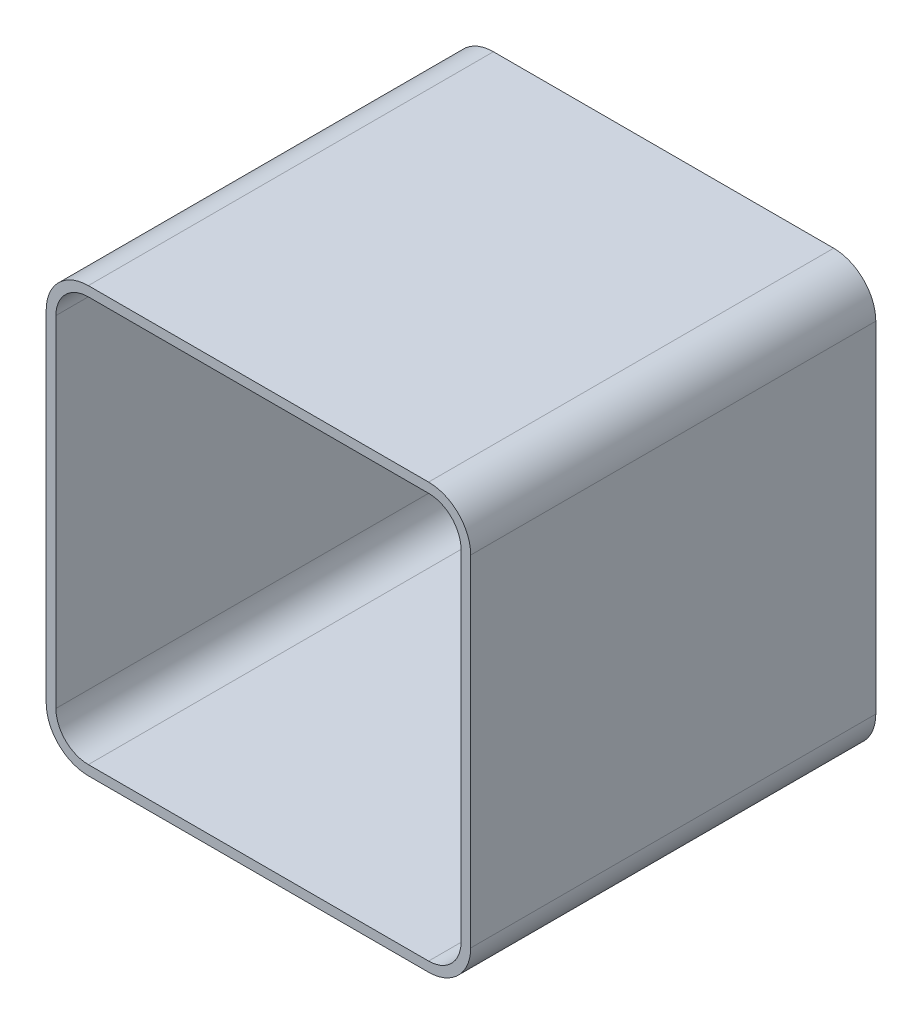
from build123d import *

# Parameters (mm, degrees)
SKETCH1_W           = 26.2
SKETCH1_H           = 26.2
SKETCH1_W_2         = 25
SKETCH1_H_2         = 25
BOSS_EXTRUDE1_DEPTH = 25
FILLET1_R           = 2
FILLET2_R           = 2.6


with BuildPart() as part:
    # Sketch1 → Boss-Extrude1 (new body)
    with BuildSketch(Plane.XY):
        Rectangle(SKETCH1_W, SKETCH1_H)
        Rectangle(SKETCH1_W_2, SKETCH1_H_2, mode=Mode.SUBTRACT)
    extrude(amount=BOSS_EXTRUDE1_DEPTH)

    # Fillet1
    fillet1_edges = [part.edges().sort_by_distance(p)[0] for p in [
        (12.5, -12.5, 12.5),
        (12.5, 12.5, 12.5),
        (-12.5, 12.5, 12.5),
        (-12.5, -12.5, 12.5),
    ]]
    fillet(fillet1_edges, radius=FILLET1_R)

    # Fillet2
    fillet2_edges = [part.edges().sort_by_distance(p)[0] for p in [
        (13.1, -13.1, 12.5),
        (-13.1, -13.1, 12.5),
        (-13.1, 13.1, 12.5),
        (13.1, 13.1, 12.5),
    ]]
    fillet(fillet2_edges, radius=FILLET2_R)


solid = part.part
